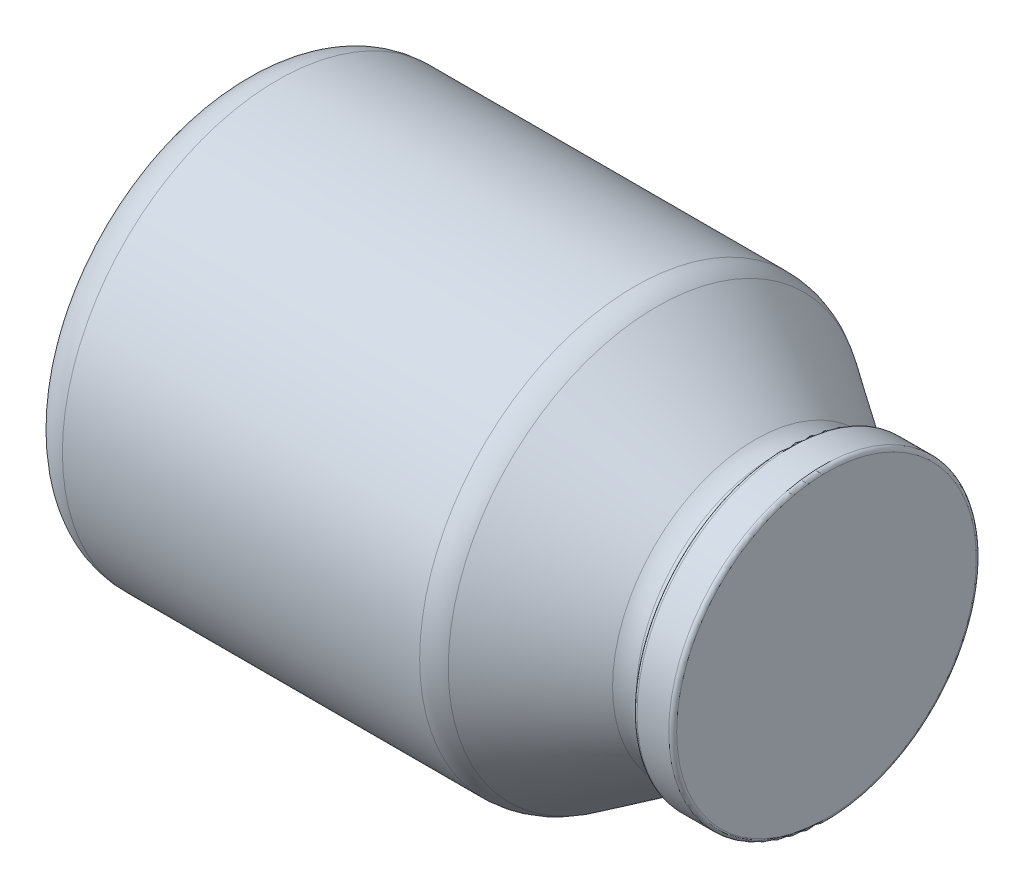
from build123d import *

# Parameters (mm, degrees)
FILLET1_R = 1.2


with BuildPart() as part:
    # Sketch1 → Revolve1 (revolve)
    with BuildSketch(Plane.XY):
        with BuildLine():
            Line((0, 0), (0, 53))
            ThreePointArc((0, 53), (3.514718626, 61.485281374), (12, 65))
            Line((12, 65), (120, 65))
            ThreePointArc((120, 65), (123.467838025, 64.48799806), (126.63975275, 62.995683239))
            Line((126.63975275, 62.995683239), (156.485534451, 43.170263967))
            ThreePointArc((156.485534451, 43.170263967), (159.128796722, 41.926668283), (162.018661743, 41.5))
            Line((162.018661743, 41.5), (166, 41.5))
            Line((166, 41.5), (166, 46.5))
            Line((166, 46.5), (178, 46.5))
            Line((178, 46.5), (178, 0))
            Line((178, 0), (0, 0))
        make_face()
    revolve(axis=Axis((0, 0, 0), (1, 0, 0)))

    # Fillet1
    fillet1_edges = [part.edges().sort_by_distance(p)[0] for p in [
        (178, -46.5, 0),
        (166, -46.5, 0),
    ]]
    fillet(fillet1_edges, radius=FILLET1_R)


solid = part.part
